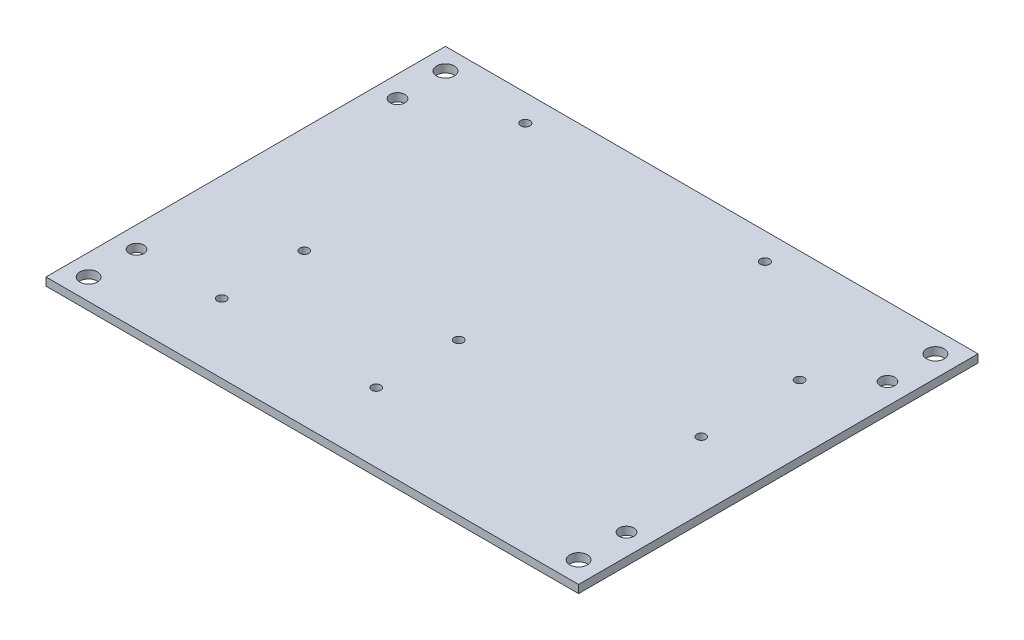
from build123d import *

# Parameters (mm, degrees)
SKETCH1_W           = 200
SKETCH1_H           = 150
BOSS_EXTRUDE1_DEPTH = 3
SKETCH2_R           = 3.3
SKETCH2_R_2         = 1.7
SKETCH2_R_3         = 2.75
SKETCH2_R_4         = 1.75
CUT_EXTRUDE1_DEPTH  = 3


with BuildPart() as part:
    # Sketch1 → Boss-Extrude1 (new body)
    with BuildSketch(Plane(origin=(0, 0, 0), x_dir=(1, 0, 0), z_dir=(0, 1, 0))):
        with Locations((100, 75)):
            Rectangle(SKETCH1_W, SKETCH1_H)
    extrude(amount=BOSS_EXTRUDE1_DEPTH)

    # Sketch2 → Cut-Extrude1 (cut)
    with BuildSketch(Plane(origin=(0, 3, 0), x_dir=(1, 0, 0), z_dir=(0, 1, 0))):
        with Locations(Location((8, 142, 0), (0, 0, 270))):
            Circle(SKETCH2_R)
        with Locations(Location((8, 8, 0), (0, 0, 90))):
            Circle(SKETCH2_R)
        with Locations(Location((192, 8, 0), (0, 0, 270))):
            Circle(SKETCH2_R)
        with Locations(Location((192, 142, 0), (0, 0, 90))):
            Circle(SKETCH2_R)
        with Locations(Location((40, 57, 0), (0, 0, 270))):
            Circle(SKETCH2_R_2)
        with Locations(Location((98, 57, 0), (0, 0, 270))):
            Circle(SKETCH2_R_2)
        with Locations(Location((98, 26, 0), (0, 0, 270))):
            Circle(SKETCH2_R_2)
        with Locations(Location((40, 26, 0), (0, 0, 270))):
            Circle(SKETCH2_R_2)
        with Locations(Location((8, 124, 0), (0, 0, 270))):
            Circle(SKETCH2_R_3)
        with Locations(Location((8, 26, 0), (0, 0, 90))):
            Circle(SKETCH2_R_3)
        with Locations(Location((192, 26, 0), (0, 0, 270))):
            Circle(SKETCH2_R_3)
        with Locations(Location((192, 124, 0), (0, 0, 90))):
            Circle(SKETCH2_R_3)
        with Locations(Location((175, 108, 0), (0, 0, 270))):
            Circle(SKETCH2_R_2)
        with Locations(Location((175, 71.07, 0), (0, 0, 270))):
            Circle(SKETCH2_R_2)
        with Locations(Location((40, 140, 0), (0, 0, 270))):
            Circle(SKETCH2_R_4)
        with Locations(Location((130, 140, 0), (0, 0, 270))):
            Circle(SKETCH2_R_4)
    extrude(amount=-CUT_EXTRUDE1_DEPTH, mode=Mode.SUBTRACT)


solid = part.part
